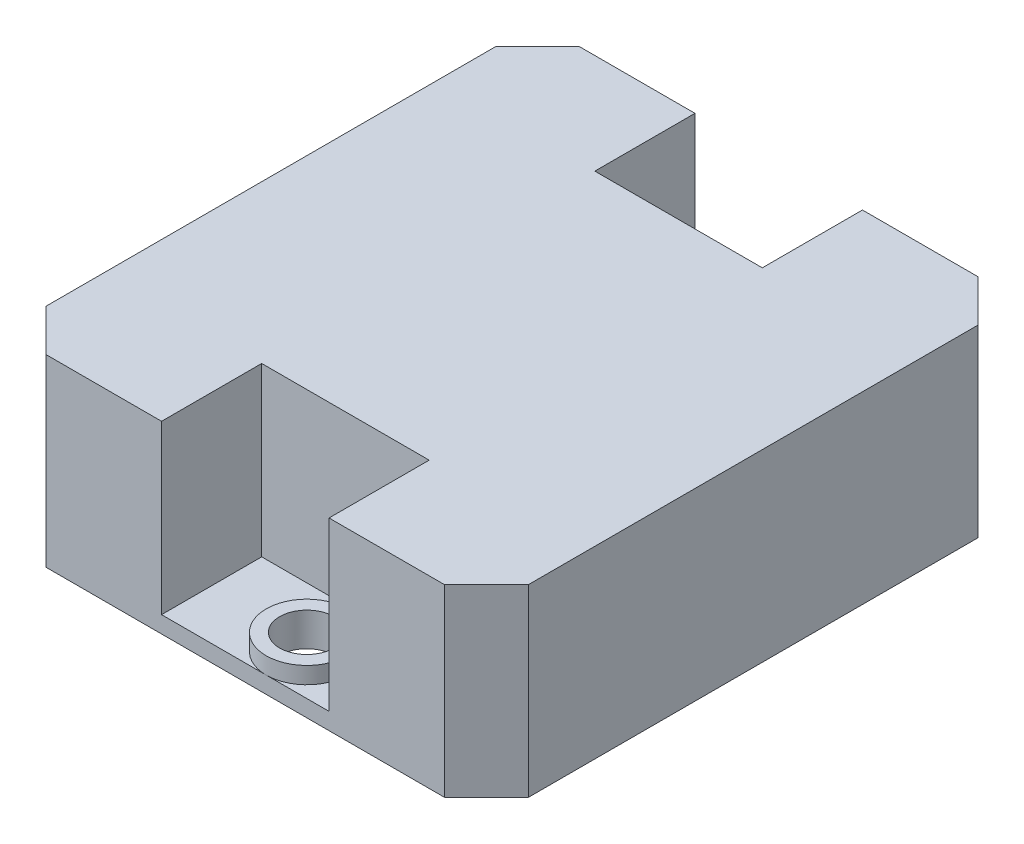
from build123d import *

# Parameters (mm, degrees)
SKETCH_1_R          = 3.25
EXTRUDE_1_DEPTH     = 22
SKETCH_2_R          = 4.85
CUT_EXTRUDE_3_DEPTH = 20
SKETCH_3_R          = 6
CUT_EXTRUDE_4_DEPTH = 18


with BuildPart() as part:
    # 草图1 → 凸台-拉伸1 (new body)
    with BuildSketch(Plane(origin=(0, 0, 0), x_dir=(1, 0, 0), z_dir=(0, 1, 0))):
        Polygon((-28.8, 26.85), (-23.8, 31.85), (23.8, 31.85), (28.8, 26.85), (28.8, -26.85), (23.8, -31.85), (-23.8, -31.85), (-28.8, -26.85), align=None)
        with Locations(Location((2.5, 27, 0), (0, 0, 270))):
            Circle(SKETCH_1_R, mode=Mode.SUBTRACT)
        with Locations(Location((2.5, -27, 0), (0, 0, 90))):
            Circle(SKETCH_1_R, mode=Mode.SUBTRACT)
    extrude(amount=EXTRUDE_1_DEPTH)

    # 草图2 → 切除-拉伸3 (cut)
    # profile 1 of 2: a face of its own
    with BuildSketch(Plane(origin=(0, 22, 0), x_dir=(1, 0, 0), z_dir=(0, 1, 0))):
        Polygon((-10, -19.891494973), (10, -19.891494973), (10, -31.85), (10, -34.308434643), (-10, -34.308434643), (-10, -31.85), align=None)
        with Locations(Location((2.5, -27, 0), (0, 0, 270))):
            Circle(SKETCH_2_R, mode=Mode.SUBTRACT)
    # profile 2 of 2: a face of its own
    with BuildSketch(Plane(origin=(0, 22, 0), x_dir=(1, 0, 0), z_dir=(0, 1, 0))):
        Polygon((-10, 19.891494973), (-10, 31.85), (-10, 34.247261474), (10, 34.247261474), (10, 31.85), (10, 19.891494973), align=None)
        with Locations(Location((2.5, 27, 0), (0, 0, 270))):
            Circle(SKETCH_2_R, mode=Mode.SUBTRACT)
    extrude(amount=-CUT_EXTRUDE_3_DEPTH, mode=Mode.SUBTRACT)

    # 草图3 → 切除-拉伸4 (cut)
    with BuildSketch(Plane(origin=(0, 22, 0), x_dir=(1, 0, 0), z_dir=(0, 1, 0))):
        with Locations((2.5, 27)):
            Circle(SKETCH_3_R)
        with Locations((2.5, -27)):
            Circle(SKETCH_3_R)
    extrude(amount=-CUT_EXTRUDE_4_DEPTH, mode=Mode.SUBTRACT)


solid = part.part
